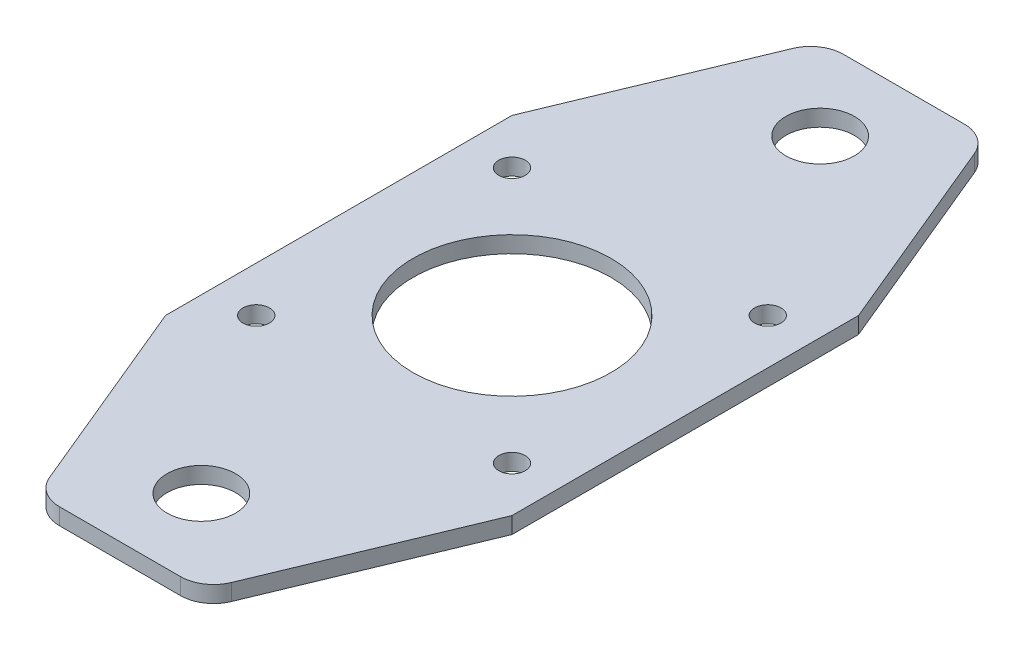
from build123d import *

# Parameters (mm, degrees)
SKETCH1_R           = 4.15
SKETCH1_W           = 42
SKETCH1_H           = 42
SKETCH1_R_2         = 1.6
SKETCH1_R_3         = 12
BOSS_EXTRUDE1_DEPTH = 2


with BuildPart() as part:
    # Sketch1 → Boss-Extrude1 (new body)
    # profile 1 of 3: a face of its own
    with BuildSketch(Plane(origin=(0, 0, 0), x_dir=(1, 0, 0), z_dir=(0, 1, 0))):
        with BuildLine():
            ThreePointArc((11.023825753, -45.033510687), (9.550490082, -46.826713299), (7.329459099, -47.5))
            Line((7.329459099, -47.5), (-7.329459099, -47.5))
            ThreePointArc((-7.329459099, -47.5), (-9.550490082, -46.826713299), (-11.023825753, -45.033510687))
            Line((-11.023825753, -45.033510687), (-21, -21))
            Line((-21, -21), (21, -21))
            Line((21, -21), (11.023825753, -45.033510687))
        make_face()
        with Locations(Location((-0.154657952, -37.5, 0), (0, 0, 270))):
            Circle(SKETCH1_R, mode=Mode.SUBTRACT)
    # profile 2 of 3: a face of its own
    with BuildSketch(Plane(origin=(0, 0, 0), x_dir=(1, 0, 0), z_dir=(0, 1, 0))):
        Rectangle(SKETCH1_W, SKETCH1_H)
        with Locations(Location((15.5, 15.5, 0), (0, 0, 270))):
            Circle(SKETCH1_R_2, mode=Mode.SUBTRACT)
        with Locations(Location((-15.5, 15.5, 0), (0, 0, 270))):
            Circle(SKETCH1_R_2, mode=Mode.SUBTRACT)
        with Locations(Location((0, 0, 0), (0, 0, 270))):
            Circle(SKETCH1_R_3, mode=Mode.SUBTRACT)
        with Locations(Location((15.5, -15.5, 0), (0, 0, 270))):
            Circle(SKETCH1_R_2, mode=Mode.SUBTRACT)
        with Locations(Location((-15.5, -15.5, 0), (0, 0, 270))):
            Circle(SKETCH1_R_2, mode=Mode.SUBTRACT)
    # profile 3 of 3: a face of its own
    with BuildSketch(Plane(origin=(0, 0, 0), x_dir=(1, 0, 0), z_dir=(0, 1, 0))):
        with BuildLine():
            ThreePointArc((-11.023825753, 45.033510687), (-9.550490082, 46.826713299), (-7.329459099, 47.5))
            Line((-7.329459099, 47.5), (7.329459099, 47.5))
            ThreePointArc((7.329459099, 47.5), (9.550490082, 46.826713299), (11.023825753, 45.033510687))
            Line((11.023825753, 45.033510687), (21, 21))
            Line((21, 21), (-21, 21))
            Line((-21, 21), (-11.023825753, 45.033510687))
        make_face()
        with Locations(Location((-0.154657952, 37.5, 0), (0, 0, 270))):
            Circle(SKETCH1_R, mode=Mode.SUBTRACT)
    extrude(amount=BOSS_EXTRUDE1_DEPTH)


solid = part.part
